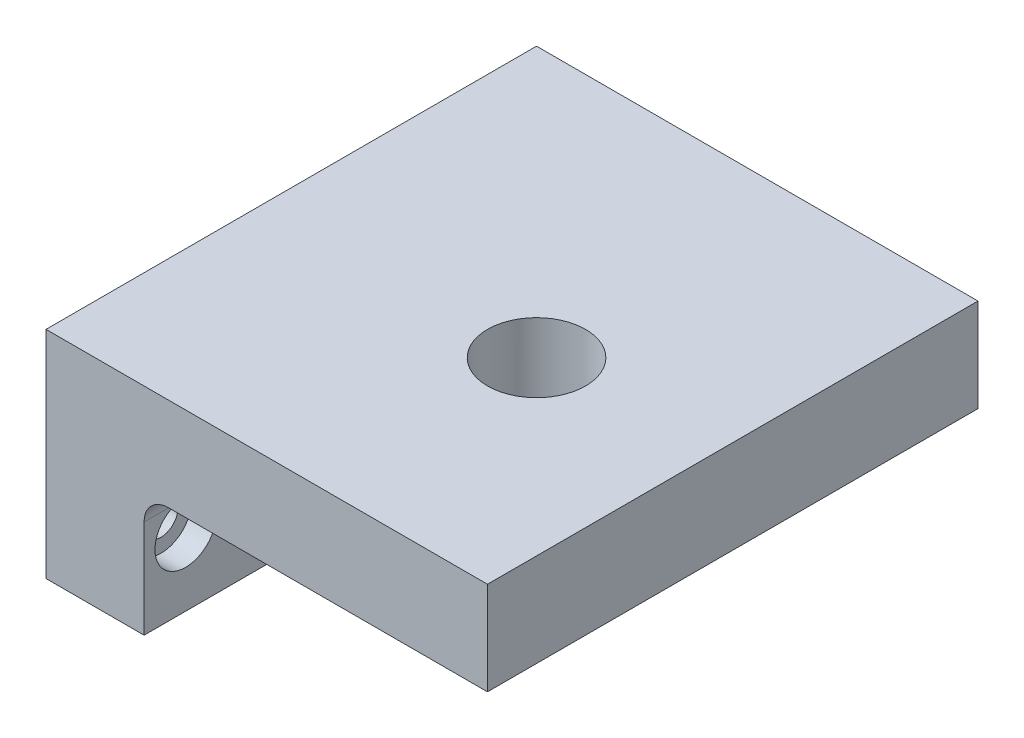
from build123d import *

# Parameters (mm, degrees)
BOSS_EXTRUDE1_DEPTH = 50.8
SKETCH2_R           = 1.7399
CUT_EXTRUDE1_DEPTH  = 45.72
FILLET1_R           = 2.54
SKETCH11_R          = 3.175
CUT_EXTRUDE5_DEPTH  = 2.54
SKETCH12_R          = 5.08
CUT_EXTRUDE6_DEPTH  = 72.906677743


with BuildPart() as part:
    # Sketch1 → Boss-Extrude1 (new body)
    with BuildSketch(Plane.XY):
        Polygon((0, 0), (0, -22.352), (10.16, -22.352), (10.16, -9.652), (45.72, -9.652), (45.72, 0), align=None)
    extrude(amount=BOSS_EXTRUDE1_DEPTH)

    # Sketch2 → Cut-Extrude1 (cut)
    with BuildSketch(Plane.ZY):
        with Locations((4.3, -15.24)):
            Circle(SKETCH2_R)
        with Locations((46.5, -15.24)):
            Circle(SKETCH2_R)
    extrude(amount=-CUT_EXTRUDE1_DEPTH, mode=Mode.SUBTRACT)

    # Fillet1
    fillet1_edges = [part.edges().sort_by_distance(p)[0] for p in [
        (10.16, -9.652, 25.4),
    ]]
    fillet(fillet1_edges, radius=FILLET1_R)

    # Sketch11 → Cut-Extrude5 (cut)
    with BuildSketch(Plane(origin=(10.16, 0, 0), x_dir=(0, 0, -1), z_dir=(1, 0, 0))):
        with Locations((-46.5, -15.24)):
            Circle(SKETCH11_R)
        with Locations((-4.3, -15.24)):
            Circle(SKETCH11_R)
    extrude(amount=-CUT_EXTRUDE5_DEPTH, mode=Mode.SUBTRACT)

    # Sketch12 → Cut-Extrude6 (cut, through all)
    with BuildSketch(Plane(origin=(0, 0, 0), x_dir=(1, 0, 0), z_dir=(0, 1, 0))):
        with Locations((27.94, -27.94)):
            Circle(SKETCH12_R)
    extrude(amount=-CUT_EXTRUDE6_DEPTH, mode=Mode.SUBTRACT)


solid = part.part
